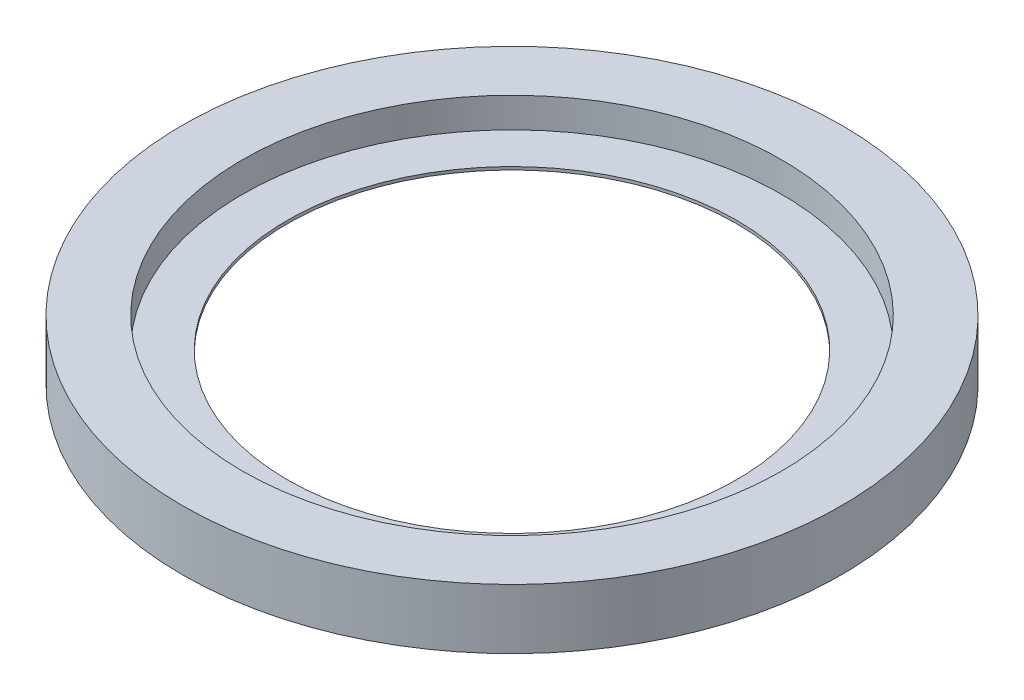
from build123d import *

# Parameters (mm, degrees)
SKETCH1_R           = 11
SKETCH1_R_2         = 9
BOSS_EXTRUDE1_DEPTH = 2
BOSS_EXTRUDE2_START = -1.1
SKETCH3_R           = 9
SKETCH3_R_2         = 7.5
BOSS_EXTRUDE2_DEPTH = 0.1


with BuildPart() as part:
    # Sketch1 → Boss-Extrude1 (new body)
    with BuildSketch(Plane(origin=(0, 0, 0), x_dir=(1, 0, 0), z_dir=(0, 1, 0))):
        with Locations(Location((0, 0, 0), (0, 0, 270))):
            Circle(SKETCH1_R)
        with Locations(Location((0, 0, 0), (0, 0, 270))):
            Circle(SKETCH1_R_2, mode=Mode.SUBTRACT)
    extrude(amount=BOSS_EXTRUDE1_DEPTH)

    # Sketch3 → Boss-Extrude2 (add)
    with BuildSketch(Plane(origin=(0, 2, 0), x_dir=(1, 0, 0), z_dir=(0, 1, 0)).offset(BOSS_EXTRUDE2_START)):
        with Locations(Location((0, 0, 0), (0, 0, 270))):
            Circle(SKETCH3_R)
        with Locations(Location((0, 0, 0), (0, 0, 270))):
            Circle(SKETCH3_R_2, mode=Mode.SUBTRACT)
    extrude(amount=BOSS_EXTRUDE2_DEPTH)


solid = part.part
